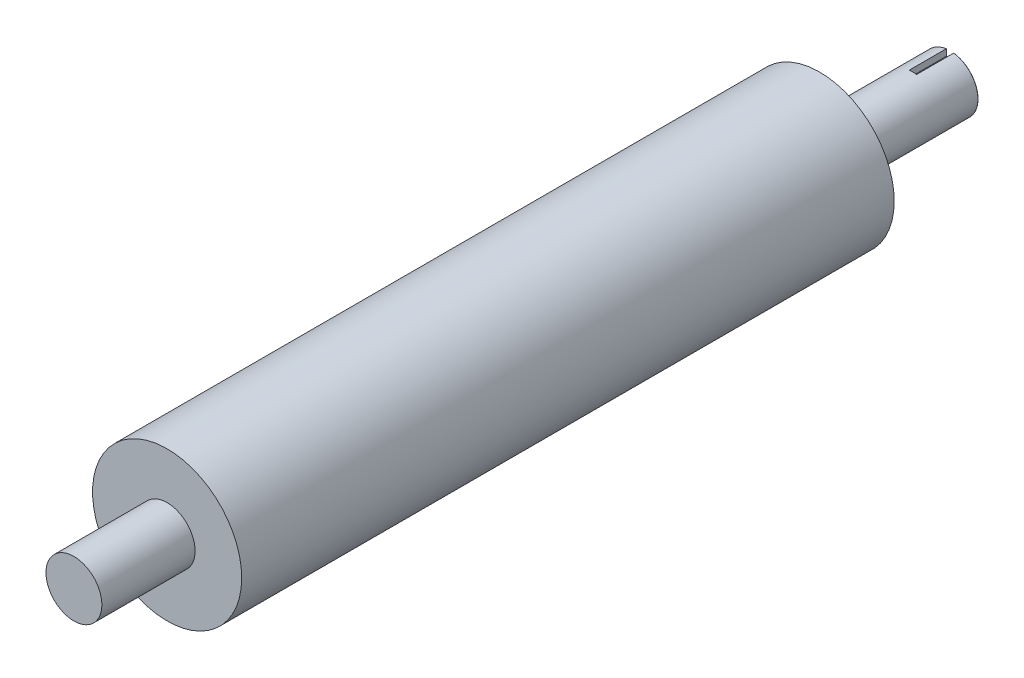
from build123d import *

# Parameters (mm, degrees)
SKETCH1_R           = 40
BOSS_EXTRUDE1_DEPTH = 350
SKETCH2_R           = 15
BOSS_EXTRUDE2_DEPTH = 50
BOSS_EXTRUDE4_START = 70
SKETCH4_R           = 15
BOSS_EXTRUDE4_DEPTH = 70
CUT_EXTRUDE1_DEPTH  = 20
FILLET2_R           = 0.1


with BuildPart() as part:
    # Sketch1 → Boss-Extrude1 (new body)
    with BuildSketch(Plane.XY):
        Circle(SKETCH1_R)
    extrude(amount=BOSS_EXTRUDE1_DEPTH)

    # Sketch2 → Boss-Extrude2 (add)
    with BuildSketch(Plane.XY.offset(350)):
        Circle(SKETCH2_R)
    extrude(amount=BOSS_EXTRUDE2_DEPTH)

    # Sketch4 → Boss-Extrude4 (add)
    with BuildSketch(Plane(origin=(0, 0, 0), x_dir=(-1, 0, 0), z_dir=(0, 0, -1)).offset(BOSS_EXTRUDE4_START)):
        with Locations(Location((0, 0, 0), (0, 0, 180))):
            Circle(SKETCH4_R)
    extrude(amount=-BOSS_EXTRUDE4_DEPTH)

    # Sketch5 → Cut-Extrude1 (cut)
    with BuildSketch(Plane(origin=(0, 0, -70), x_dir=(-1, 0, 0), z_dir=(0, 0, -1))):
        with BuildLine():
            Line((-2, 11.324751653), (-2, 14.866068747))
            ThreePointArc((-2, 14.866068747), (0, 15), (2, 14.866068747))
            Line((2, 14.866068747), (2, 11.324751653))
            ThreePointArc((2, 11.324751653), (0, 11.5), (-2, 11.324751653))
        make_face()
    extrude(amount=-CUT_EXTRUDE1_DEPTH, mode=Mode.SUBTRACT)

    # Fillet2
    fillet2_edges = [part.edges().sort_by_distance(p)[0] for p in [
        (-9.874208829, -11.291589791, -70),
    ]]
    fillet(fillet2_edges, radius=FILLET2_R)


solid = part.part
